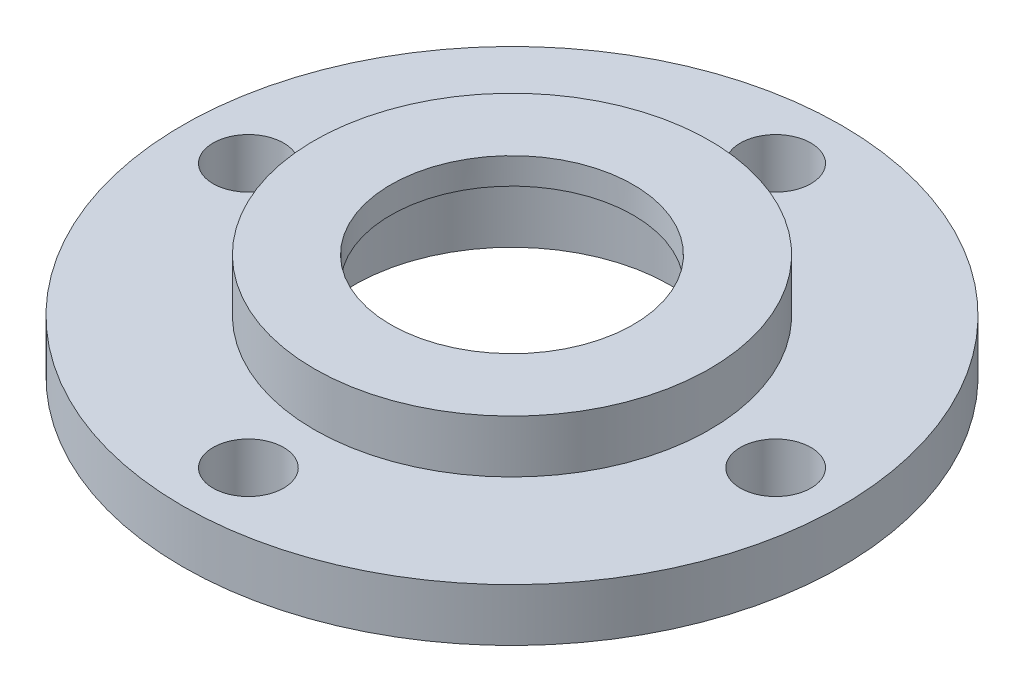
from build123d import *

# Parameters (mm, degrees)
SKETCH1_R           = 15.875
BOSS_EXTRUDE1_DEPTH = 2.54
SKETCH2_R           = 9.525
BOSS_EXTRUDE2_DEPTH = 2.54
SKETCH3_R           = 7.62
CUT_EXTRUDE1_DEPTH  = 3.81
CUT_EXTRUDE2_REACH  = 25.018
SKETCH4_R           = 5.842
CUT_EXTRUDE3_REACH  = 24.594
SKETCH5_R           = 1.7


with BuildPart() as part:
    # Sketch1 → Boss-Extrude1 (new body)
    with BuildSketch(Plane(origin=(0, 0, 0), x_dir=(1, 0, 0), z_dir=(0, 1, 0))):
        with Locations(Location((0, 0, 0), (0, 0, 270))):
            Circle(SKETCH1_R)
    extrude(amount=BOSS_EXTRUDE1_DEPTH)

    # Sketch2 → Boss-Extrude2 (add)
    with BuildSketch(Plane(origin=(0, 2.54, 0), x_dir=(1, 0, 0), z_dir=(0, 1, 0))):
        with Locations(Location((0, 0, 0), (0, 0, 270))):
            Circle(SKETCH2_R)
    extrude(amount=BOSS_EXTRUDE2_DEPTH)

    # Sketch3 → Cut-Extrude1 (cut)
    with BuildSketch(Plane.XZ):
        with Locations(Location((0, 0, 0), (0, 0, 270))):
            Circle(SKETCH3_R)
    extrude(amount=-CUT_EXTRUDE1_DEPTH, mode=Mode.SUBTRACT)

    # Sketch4 → Cut-Extrude2 (cut, up to next)
    with BuildSketch(Plane(origin=(0, 5.08, 0), x_dir=(1, 0, 0), z_dir=(0, 1, 0)), mode=Mode.PRIVATE) as cut_extrude2_sk1:
        with Locations(Location((0, 0, 0), (0, 0, 270))):
            Circle(SKETCH4_R)
    cut_extrude2_tool1 = extrude(cut_extrude2_sk1.sketch, amount=-CUT_EXTRUDE2_REACH, mode=Mode.PRIVATE) & part.part
    add(cut_extrude2_tool1.solids().sort_by_distance((0, 5.08, 0))[0], mode=Mode.SUBTRACT)

    # Sketch5 → Cut-Extrude3 (cut, up to next)
    with BuildSketch(Plane(origin=(0, 2.54, 0), x_dir=(1, 0, 0), z_dir=(0, 1, 0)), mode=Mode.PRIVATE) as cut_extrude3_sk1:
        with Locations(Location((0, 12.7, 0), (0, 0, 270))):
            Circle(SKETCH5_R)
    cut_extrude3_tool1 = extrude(cut_extrude3_sk1.sketch, amount=-CUT_EXTRUDE3_REACH, mode=Mode.PRIVATE) & part.part
    # Sketch5 → Cut-Extrude3 (cut, up to next)
    with BuildSketch(Plane(origin=(0, 2.54, 0), x_dir=(1, 0, 0), z_dir=(0, 1, 0)), mode=Mode.PRIVATE) as cut_extrude3_sk2:
        with Locations(Location((12.7, 0, 0), (0, 0, 270))):
            Circle(SKETCH5_R)
    cut_extrude3_tool2 = extrude(cut_extrude3_sk2.sketch, amount=-CUT_EXTRUDE3_REACH, mode=Mode.PRIVATE) & part.part
    # Sketch5 → Cut-Extrude3 (cut, up to next)
    with BuildSketch(Plane(origin=(0, 2.54, 0), x_dir=(1, 0, 0), z_dir=(0, 1, 0)), mode=Mode.PRIVATE) as cut_extrude3_sk3:
        with Locations(Location((0, -12.7, 0), (0, 0, 270))):
            Circle(SKETCH5_R)
    cut_extrude3_tool3 = extrude(cut_extrude3_sk3.sketch, amount=-CUT_EXTRUDE3_REACH, mode=Mode.PRIVATE) & part.part
    # Sketch5 → Cut-Extrude3 (cut, up to next)
    with BuildSketch(Plane(origin=(0, 2.54, 0), x_dir=(1, 0, 0), z_dir=(0, 1, 0)), mode=Mode.PRIVATE) as cut_extrude3_sk4:
        with Locations(Location((-12.7, 0, 0), (0, 0, 270))):
            Circle(SKETCH5_R)
    cut_extrude3_tool4 = extrude(cut_extrude3_sk4.sketch, amount=-CUT_EXTRUDE3_REACH, mode=Mode.PRIVATE) & part.part
    add(cut_extrude3_tool1.solids().sort_by_distance((0, 2.54, -12.7))[0], mode=Mode.SUBTRACT)
    add(cut_extrude3_tool2.solids().sort_by_distance((12.7, 2.54, 0))[0], mode=Mode.SUBTRACT)
    add(cut_extrude3_tool3.solids().sort_by_distance((0, 2.54, 12.7))[0], mode=Mode.SUBTRACT)
    add(cut_extrude3_tool4.solids().sort_by_distance((-12.7, 2.54, 0))[0], mode=Mode.SUBTRACT)


solid = part.part
